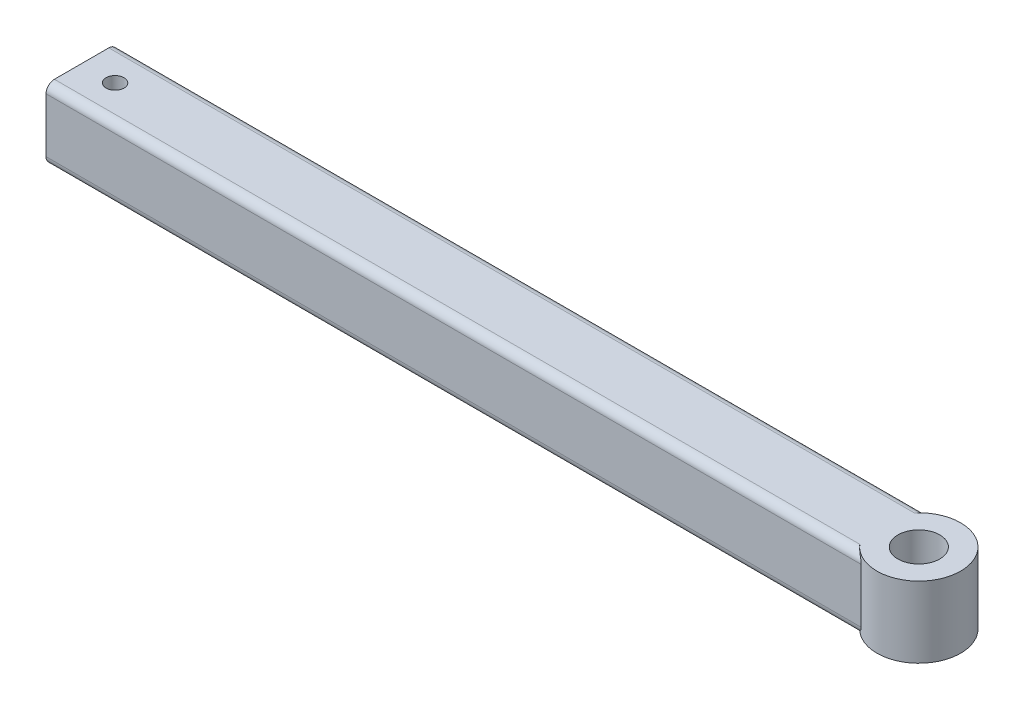
from build123d import *

# Parameters (mm, degrees)
RESSALTO_EXTRUS_O1_DEPTH = 17
ESBO_O3_R                = 5
CORTE_EXTRUS_O2_DEPTH    = 212.497635921
CORTE_EXTRUS_O3_DEPTH    = 20
CHANFRO1_SIZE            = 0.5
ESBO_O5_R                = 6
CORTE_EXTRUS_O4_DEPTH    = 3.5
CORTE_EXTRUS_O4_DRAFT    = -35
FILETE1_R                = 2
ESBO_O6_R                = 2.15
CORTE_EXTRUS_O5_DEPTH    = 212.497636037


with BuildPart() as part:
    # Esboço1 → Ressalto-extrusão1 (new body)
    with BuildSketch(Plane(origin=(0, 0, 0), x_dir=(1, 0, 0), z_dir=(0, 1, 0))):
        with BuildLine():
            Line((0, 17), (194.732173124, 17))
            ThreePointArc((194.732173124, 17), (210, 8.5), (194.732173124, 0))
            Line((194.732173124, 0), (0, 0))
            Line((0, 0), (0, 17))
        make_face()
    extrude(amount=RESSALTO_EXTRUS_O1_DEPTH)

    # Esboço3 → Corte-extrusão2 (cut, through all)
    with BuildSketch(Plane(origin=(0, 17, 0), x_dir=(1, 0, 0), z_dir=(0, 1, 0))):
        with Locations((200, 8.5)):
            Circle(ESBO_O3_R)
    extrude(amount=-CORTE_EXTRUS_O2_DEPTH, mode=Mode.SUBTRACT)

    # Esboço4 → Corte-extrusão3 (cut)
    with BuildSketch(Plane.ZY):
        with BuildLine():
            Line((-7.25, 12.25), (-4.75, 12.25))
            Line((-4.75, 12.25), (-4.75, 9.75))
            ThreePointArc((-4.75, 9.75), (-4.224744871, 8.5), (-4.75, 7.25))
            Line((-4.75, 7.25), (-4.75, 4.75))
            Line((-4.75, 4.75), (-7.25, 4.75))
            ThreePointArc((-7.25, 4.75), (-8.5, 4.224744871), (-9.75, 4.75))
            Line((-9.75, 4.75), (-12.25, 4.75))
            Line((-12.25, 4.75), (-12.25, 7.25))
            ThreePointArc((-12.25, 7.25), (-12.775255129, 8.5), (-12.25, 9.75))
            Line((-12.25, 9.75), (-12.25, 12.25))
            Line((-12.25, 12.25), (-9.75, 12.25))
            ThreePointArc((-9.75, 12.25), (-8.5, 12.775255129), (-7.25, 12.25))
        make_face()
    extrude(amount=-CORTE_EXTRUS_O3_DEPTH, mode=Mode.SUBTRACT)

    # Chanfro1
    chanfro1_edges = [part.edges().sort_by_distance(p)[0] for p in [
        (10, 4.75, -12.25),
        (10, 12.25, -12.25),
        (10, 12.25, -4.75),
        (10, 4.75, -4.75),
    ]]
    chamfer(chanfro1_edges, length=CHANFRO1_SIZE)


with BuildPart() as corte_extrus_o4_tool:
    # Esboço5 → Corte-extrusão4 (with draft: the straight prism first)
    with BuildSketch(Plane.ZY):
        with Locations((-8.5, 8.5)):
            Circle(ESBO_O5_R)
    extrude(amount=-CORTE_EXTRUS_O4_DEPTH)
    # Corte-extrusão4: the draft: its side faces are tilted about the plane it starts from
    corte_extrus_o4_sides = [corte_extrus_o4_tool.faces().sort_by_distance(p)[0] for p in [
        (1.75, 8.5, -14.5),
    ]]
    draft(corte_extrus_o4_sides, Plane.ZY, CORTE_EXTRUS_O4_DRAFT)


with BuildPart() as part_1:
    add(part.part)

    # Corte-extrusão4: cut by corte_extrus_o4_tool
    add(corte_extrus_o4_tool.part, mode=Mode.SUBTRACT)

    # Filete1
    filete1_edges = [part_1.edges().sort_by_distance(p)[0] for p in [
        (97.366086562, 0, 0),
        (97.366086562, 17, 0),
        (97.366086562, 0, -17),
        (97.366086562, 17, -17),
    ]]
    fillet(filete1_edges, radius=FILETE1_R)

    # Esboço6 → Corte-extrusão5 (cut, through all)
    with BuildSketch(Plane(origin=(0, 17, 0), x_dir=(1, 0, 0), z_dir=(0, 1, 0))):
        with Locations((8, 8.5)):
            Circle(ESBO_O6_R)
    extrude(amount=-CORTE_EXTRUS_O5_DEPTH, mode=Mode.SUBTRACT)


solid = part_1.part
